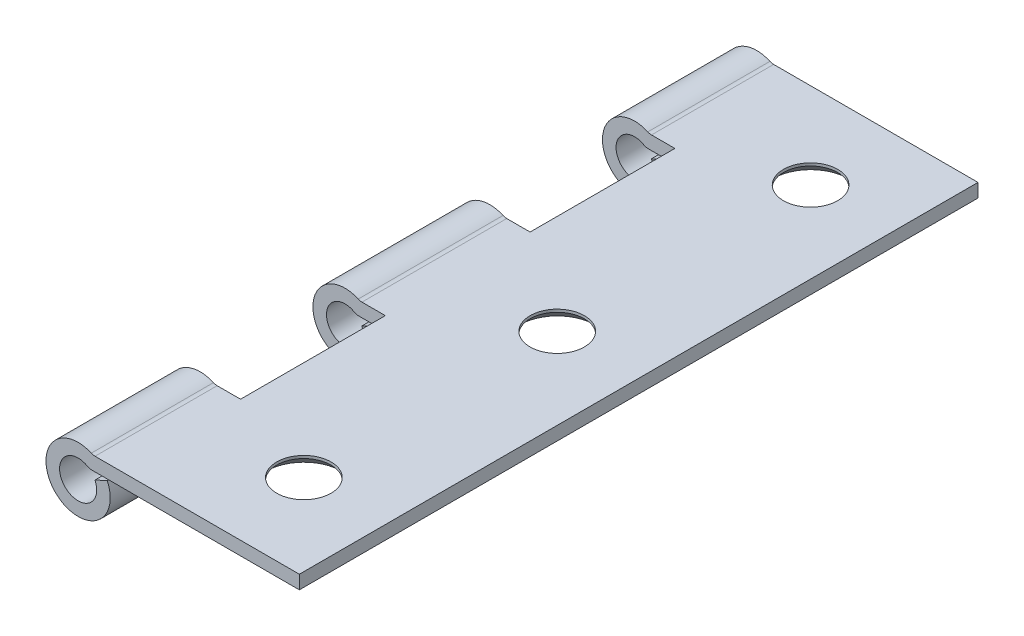
from build123d import *

# Parameters (mm, degrees)
BOSS_EXTRUDE1_DEPTH     = 37.5
SKETCH4_R               = 3
CUT_EXTRUDE3_DEPTH      = 46.067643604
LPATTERN1_COUNT         = 2
LPATTERN1_PITCH         = 28
MIRROR1_COPY_1_SKETCH_R = 3
MIRROR1_COPY_1_DEPTH    = 46.067643604
MIRROR1_COPY_2_SKETCH_R = 3
MIRROR1_COPY_2_DEPTH    = 46.067643604
CHAMFER1_SIZE           = 1.2
SKETCH2_W               = 8
SKETCH2_H               = 16
CUT_EXTRUDE4_DEPTH      = 46.067643604


with BuildPart() as part:
    # Sketch1 → Boss-Extrude1 (new, symmetric)
    with BuildSketch(Plane.XY):
        with BuildLine():
            Line((1.865475811, 3.15), (24.45, 3.15))
            Line((24.45, 3.15), (24.45, 1.65))
            Line((24.45, 1.65), (1.509966887, 1.65))
            ThreePointArc((1.509966887, 1.65), (1.253893127, 1.683342755), (1.014895777, 1.781147541))
            ThreePointArc((1.014895777, 1.781147541), (-1.507477704, -1.389248347), (1.857930963, 0.866367437))
            Line((1.857930963, 0.866367437), (3.217392644, 1.500294829))
            ThreePointArc((3.217392644, 1.500294829), (-2.492742617, -2.527594557), (1.455481127, 3.237912088))
            ThreePointArc((1.455481127, 3.237912088), (1.655818843, 3.172224997), (1.865475811, 3.15))
        make_face()
    extrude(amount=BOSS_EXTRUDE1_DEPTH, both=True)

    # Sketch4 → Cut-Extrude3 (cut, through all)
    with BuildSketch(Plane.XZ.offset(-1.65)):
        with Locations(Location((15.45, 0, 0), (0, 0, 270))):
            Circle(SKETCH4_R)
    cut_extrude3 = extrude(amount=-CUT_EXTRUDE3_DEPTH, mode=Mode.SUBTRACT)

    # LPattern1: Cut-Extrude3 ×2
    with Locations(*[(0, 0, -i * LPATTERN1_PITCH) for i in range(1, LPATTERN1_COUNT)]):
        add(cut_extrude3, mode=Mode.SUBTRACT)

    # Mirror1 copy 1 sketch → Mirror1 copy 1 (cut, through all)
    with BuildSketch(Plane(origin=(0, 1.65, 28), x_dir=(1, 0, 0), z_dir=(0, -1, 0))):
        with Locations((15.45, 0)):
            Circle(MIRROR1_COPY_1_SKETCH_R)
    extrude(amount=-MIRROR1_COPY_1_DEPTH, mode=Mode.SUBTRACT)

    # Mirror1 copy 2 sketch → Mirror1 copy 2 (cut, through all)
    with BuildSketch(Plane.XZ.offset(-1.65)):
        with Locations((15.45, 0)):
            Circle(MIRROR1_COPY_2_SKETCH_R)
    extrude(amount=-MIRROR1_COPY_2_DEPTH, mode=Mode.SUBTRACT)

    # Chamfer1
    chamfer1_edges = [part.edges().sort_by_distance(p)[0] for p in [
        (15.45, 1.65, 3),
        (15.45, 1.65, -25),
        (12.45, 1.65, 28),
    ]]
    chamfer(chamfer1_edges, length=CHAMFER1_SIZE)

    # Sketch2 → Cut-Extrude4 (cut, symmetric)
    with BuildSketch(Plane.XZ.offset(-1.65)):
        with Locations((0.45, -16)):
            Rectangle(SKETCH2_W, SKETCH2_H)
    cut_extrude4 = extrude(amount=CUT_EXTRUDE4_DEPTH, both=True, mode=Mode.SUBTRACT)

    # Mirror2: Cut-Extrude4 across plane
    add(cut_extrude4.mirror(Plane.XY), mode=Mode.SUBTRACT)


solid = part.part
